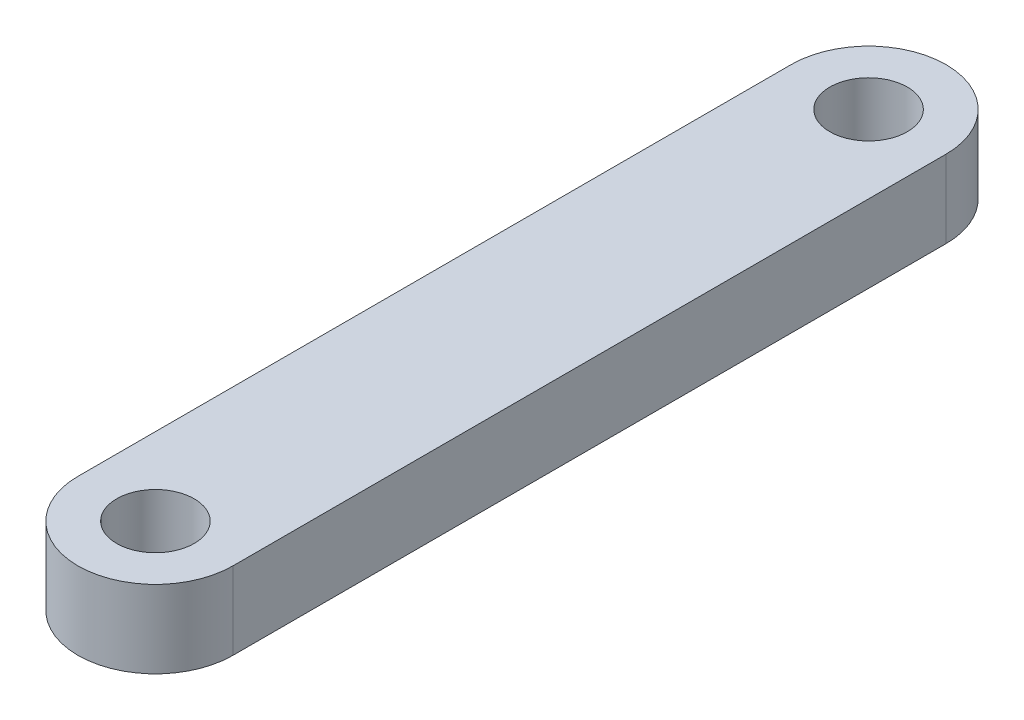
from build123d import *

# Parameters (mm, degrees)
SKETCH1_R           = 3.175
BOSS_EXTRUDE1_DEPTH = 3.175


with BuildPart() as part:
    # Sketch1 → Boss-Extrude1 (new, symmetric)
    with BuildSketch(Plane(origin=(0, 0, 0), x_dir=(1, 0, 0), z_dir=(0, 1, 0))):
        with BuildLine():
            Line((-6.35, 0), (-6.35, 58.42))
            ThreePointArc((-6.35, 58.42), (0, 64.77), (6.35, 58.42))
            Line((6.35, 58.42), (6.35, 0))
            ThreePointArc((6.35, 0), (0, -6.35), (-6.35, 0))
        make_face()
        with Locations(Location((0, 58.42, 0), (0, 0, 270))):
            Circle(SKETCH1_R, mode=Mode.SUBTRACT)
        with Locations(Location((0, 0, 0), (0, 0, 270))):
            Circle(SKETCH1_R, mode=Mode.SUBTRACT)
    extrude(amount=BOSS_EXTRUDE1_DEPTH, both=True)


solid = part.part
